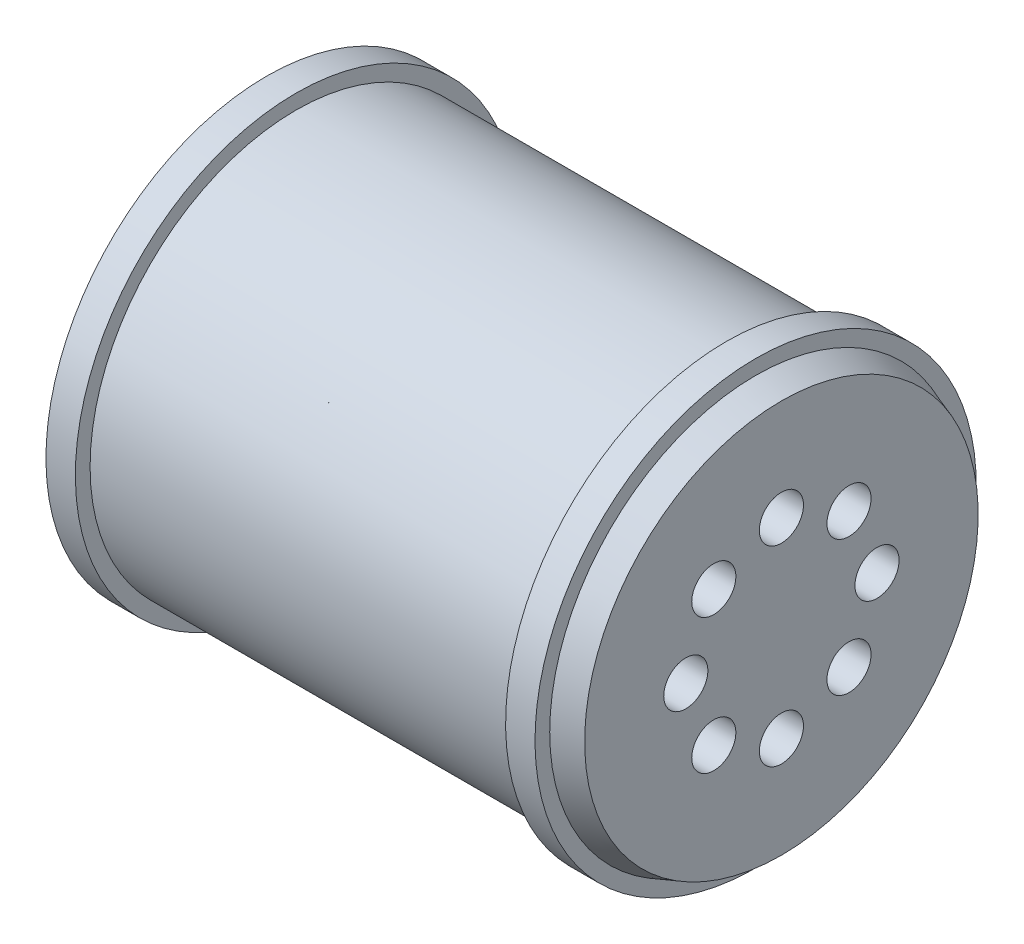
from build123d import *

# Parameters (mm, degrees)
SKETCH3_R          = 1.5
CUT_EXTRUDE1_DEPTH = 32
CUT_EXTRUDE2_DEPTH = 10


with BuildPart() as part:
    # Sketch2 → Revolve1 (revolve)
    with BuildSketch(Plane.XY):
        Polygon((18.248024071, 0), (-8.751975929, 0), (-8.751975929, 8.5), (-16.751975929, 8.5), (-16.751975929, 15), (-14.751975929, 15), (-14.751975929, 14), (14.496314122, 14), (14.496314122, 15), (16.496314122, 15), (16.496314122, 14), (18.248024071, 13.376380745), align=None)
    revolve(axis=Axis((18.248024071, 0, 0), (-1, 0, 0)))

    # Sketch3 → Cut-Extrude1 (cut)
    with BuildSketch(Plane.ZY.offset(8.751975929)):
        with Locations(Location((0, 6.5, 0), (0, 0, 270))):
            Circle(SKETCH3_R)
        with Locations(Location((4.596194078, 4.596194078, 0), (0, 0, 270))):
            Circle(SKETCH3_R)
        with Locations(Location((6.5, 0, 0), (0, 0, 270))):
            Circle(SKETCH3_R)
        with Locations(Location((4.596194078, -4.596194078, 0), (0, 0, 270))):
            Circle(SKETCH3_R)
        with Locations(Location((0, -6.5, 0), (0, 0, 270))):
            Circle(SKETCH3_R)
        with Locations(Location((-4.596194078, -4.596194078, 0), (0, 0, 270))):
            Circle(SKETCH3_R)
        with Locations(Location((-6.5, 0, 0), (0, 0, 270))):
            Circle(SKETCH3_R)
        with Locations(Location((-4.596194078, 4.596194078, 0), (0, 0, 270))):
            Circle(SKETCH3_R)
    extrude(amount=-CUT_EXTRUDE1_DEPTH, mode=Mode.SUBTRACT)

    # Sketch4 → Cut-Extrude2 (cut)
    with BuildSketch(Plane.ZY.offset(8.751975929)):
        with BuildLine():
            Line((0.829156198, 1.25), (0.829156198, -1.25))
            ThreePointArc((0.829156198, -1.25), (-1.5, 0), (0.829156198, 1.25))
        make_face()
    extrude(amount=-CUT_EXTRUDE2_DEPTH, mode=Mode.SUBTRACT)


solid = part.part
